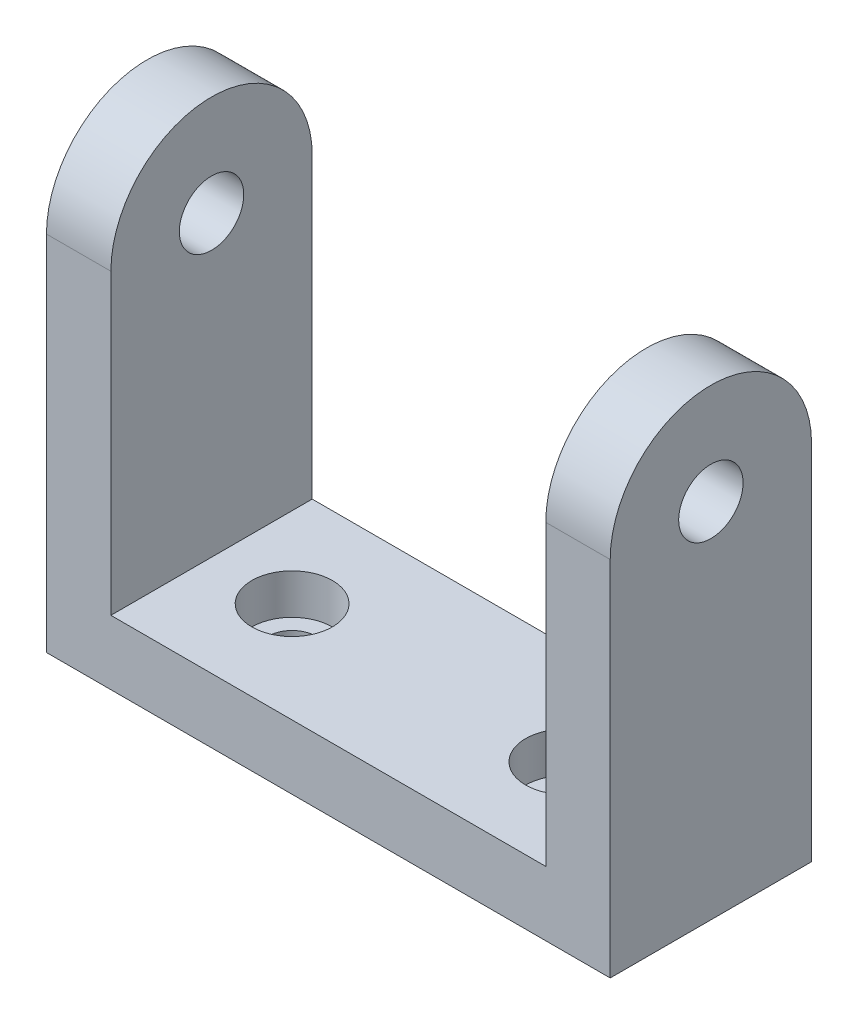
from build123d import *

# Parameters (mm, degrees)
BOSS_EXTRUDE1_DEPTH     = 12.5
FILLET1_RADIUS          = 12.5
FILLET1_LENGTH          = 8
FILLET2_RADIUS          = 12.5
FILLET2_LENGTH          = 8
CUT_EXTRUDE1_DEPTH      = 87.640060018
CUT_EXTRUDE1_DEPTH_BACK = 87.640060018
SKETCH3_R               = 4
SKETCH4_R               = 3
CUT_EXTRUDE4_DEPTH      = 62.899111464
SKETCH4_4_R             = 5
CUT_EXTRUDE6_DEPTH      = 5


with BuildPart() as part:
    # Sketch1 → Boss-Extrude1 (new, symmetric)
    with BuildSketch(Plane.XY):
        Polygon((27, 0), (-27, 0), (-27, 49.5), (-35, 49.5), (-35, -8), (35, -8), (35, 49.5), (27, 49.5), align=None)
    extrude(amount=BOSS_EXTRUDE1_DEPTH, both=True)

    # Fillet1: full round fillet: the end face becomes a half cylinder, R = half its width
    fillet1_face = Plane((-31, 49.5, 0), x_dir=(-1, 0, 0), z_dir=(0, 1, 0))  # on the end face: x along it, z out of the body
    fillet1_slab = fillet1_face.offset(-FILLET1_RADIUS / 2) * Box(FILLET1_LENGTH, 2 * FILLET1_RADIUS, FILLET1_RADIUS, mode=Mode.PRIVATE)  # the body's end, R deep
    fillet1_round = Plane((-31, 37, 0), x_dir=(0, 1, 0), z_dir=(-1, 0, 0)) * Cylinder(FILLET1_RADIUS, FILLET1_LENGTH, mode=Mode.PRIVATE)  # its axis R under the face
    add(fillet1_slab - fillet1_round, mode=Mode.SUBTRACT)

    # Fillet2: full round fillet: the end face becomes a half cylinder, R = half its width
    fillet2_face = Plane((31, 49.5, 0), x_dir=(1, 0, 0), z_dir=(0, 1, 0))  # on the end face: x along it, z out of the body
    fillet2_slab = fillet2_face.offset(-FILLET2_RADIUS / 2) * Box(FILLET2_LENGTH, 2 * FILLET2_RADIUS, FILLET2_RADIUS, mode=Mode.PRIVATE)  # the body's end, R deep
    fillet2_round = Plane((31, 37, 0), x_dir=(0, 1, 0), z_dir=(1, 0, 0)) * Cylinder(FILLET2_RADIUS, FILLET2_LENGTH, mode=Mode.PRIVATE)  # its axis R under the face
    add(fillet2_slab - fillet2_round, mode=Mode.SUBTRACT)

    # Sketch3 → Cut-Extrude1 (cut, two sides: drawn at the far end of the back side and taken through both)
    with BuildSketch(Plane.ZY.offset(35).offset(-CUT_EXTRUDE1_DEPTH_BACK)):
        with Locations(Location((0, 37, 0), (0, 0, 270))):
            Circle(SKETCH3_R)
    extrude(amount=CUT_EXTRUDE1_DEPTH + CUT_EXTRUDE1_DEPTH_BACK, mode=Mode.SUBTRACT)

    # Sketch4 → Cut-Extrude4 (cut, through all)
    with BuildSketch(Plane(origin=(0, 0, 0), x_dir=(1, 0, 0), z_dir=(0, 1, 0))):
        with Locations(Location((-17, 0, 0), (0, 0, 180))):
            Circle(SKETCH4_R)
        with Locations((17, 0)):
            Circle(SKETCH4_R)
    extrude(amount=-CUT_EXTRUDE4_DEPTH, mode=Mode.SUBTRACT)

    # Sketch4<4> → Cut-Extrude6 (cut)
    with BuildSketch(Plane(origin=(0, 0, 0), x_dir=(1, 0, 0), z_dir=(0, 1, 0))):
        with Locations(Location((-17, 0, 0), (0, 0, 180))):
            Circle(SKETCH4_4_R)
        with Locations((17, 0)):
            Circle(SKETCH4_4_R)
    extrude(amount=-CUT_EXTRUDE6_DEPTH, mode=Mode.SUBTRACT)


solid = part.part
